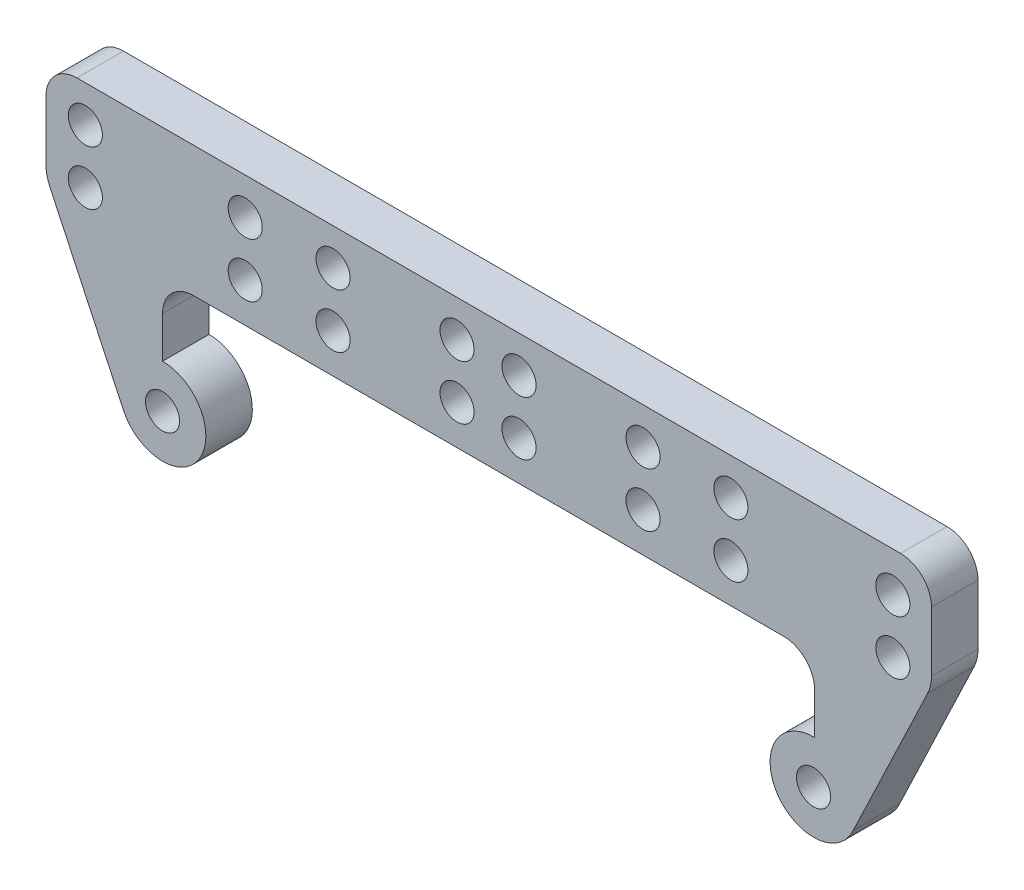
from build123d import *

# Parameters (mm, degrees)
SKETCH_1_R      = 1.65
EXTRUDE_1_DEPTH = 4.5


with BuildPart() as part:
    # 草图1 → 凸台-拉伸1 (new body)
    with BuildSketch(Plane.XY):
        with BuildLine():
            Line((7985.952332202, 5156.773837904), (7985.952332202, 5150.976359203))
            ThreePointArc((7985.952332202, 5150.976359203), (7986.043696587, 5150.147298626), (7986.313404682, 5149.358029069))
            Line((7986.313404682, 5149.358029069), (7993.434341187, 5134.194369164))
            ThreePointArc((7993.434341187, 5134.194369164), (8000.767739464, 5133.728654178), (7997.228995286, 5140.168600636))
            Line((7997.228995286, 5140.168600636), (7997.228995286, 5144.169137786))
            ThreePointArc((7997.228995286, 5144.169137786), (7998.107674943, 5146.290458129), (8000.228995286, 5147.169137786))
            Line((8000.228995286, 5147.169137786), (8057.335847124, 5147.169137786))
            ThreePointArc((8057.335847124, 5147.169137786), (8059.457167467, 5146.290458129), (8060.335847124, 5144.169137786))
            Line((8060.335847124, 5144.169137786), (8060.335847124, 5140.181434516))
            ThreePointArc((8060.335847124, 5140.181434516), (8056.672629109, 5133.729954227), (8064.072159737, 5134.266340868))
            Line((8064.072159737, 5134.266340868), (8071.275990148, 5149.357818804))
            ThreePointArc((8071.275990148, 5149.357818804), (8071.552278457, 5150.153987911), (8071.645915883, 5150.991515528))
            Line((8071.645915883, 5150.991515528), (8071.645915883, 5156.773837904))
            ThreePointArc((8071.645915883, 5156.773837904), (8070.767236227, 5158.895158248), (8068.645915883, 5159.773837904))
            Line((8068.645915883, 5159.773837904), (7988.952332202, 5159.773837904))
            ThreePointArc((7988.952332202, 5159.773837904), (7986.831011858, 5158.895158248), (7985.952332202, 5156.773837904))
        make_face()
        with Locations((7997.228995286, 5135.976359203)):
            Circle(SKETCH_1_R, mode=Mode.SUBTRACT)
        with Locations((8005.228995286, 5150.976359203)):
            Circle(SKETCH_1_R, mode=Mode.SUBTRACT)
        with Locations((8052.228995286, 5150.976359203)):
            Circle(SKETCH_1_R, mode=Mode.SUBTRACT)
        with Locations((8013.728995286, 5150.976359203)):
            Circle(SKETCH_1_R, mode=Mode.SUBTRACT)
        with Locations((8043.728995286, 5150.976359203)):
            Circle(SKETCH_1_R, mode=Mode.SUBTRACT)
        with Locations((8060.228995286, 5135.976359203)):
            Circle(SKETCH_1_R, mode=Mode.SUBTRACT)
        with Locations((7989.759553619, 5150.976359203)):
            Circle(SKETCH_1_R, mode=Mode.SUBTRACT)
        with Locations((8067.903645142, 5150.680599992)):
            Circle(SKETCH_1_R, mode=Mode.SUBTRACT)
        with Locations((8025.728995286, 5150.976359203)):
            Circle(SKETCH_1_R, mode=Mode.SUBTRACT)
        with Locations((8031.728995286, 5150.976359203)):
            Circle(SKETCH_1_R, mode=Mode.SUBTRACT)
        with Locations((8005.228995286, 5156.218532456)):
            Circle(SKETCH_1_R, mode=Mode.SUBTRACT)
        with Locations((8052.228995286, 5156.218532456)):
            Circle(SKETCH_1_R, mode=Mode.SUBTRACT)
        with Locations((8013.728995286, 5156.218532456)):
            Circle(SKETCH_1_R, mode=Mode.SUBTRACT)
        with Locations((8043.728995286, 5156.218532456)):
            Circle(SKETCH_1_R, mode=Mode.SUBTRACT)
        with Locations((7989.759553619, 5156.218532456)):
            Circle(SKETCH_1_R, mode=Mode.SUBTRACT)
        with Locations((8067.903645142, 5155.922773245)):
            Circle(SKETCH_1_R, mode=Mode.SUBTRACT)
        with Locations((8025.728995286, 5156.218532456)):
            Circle(SKETCH_1_R, mode=Mode.SUBTRACT)
        with Locations((8031.728995286, 5156.218532456)):
            Circle(SKETCH_1_R, mode=Mode.SUBTRACT)
    extrude(amount=EXTRUDE_1_DEPTH)


solid = part.part
